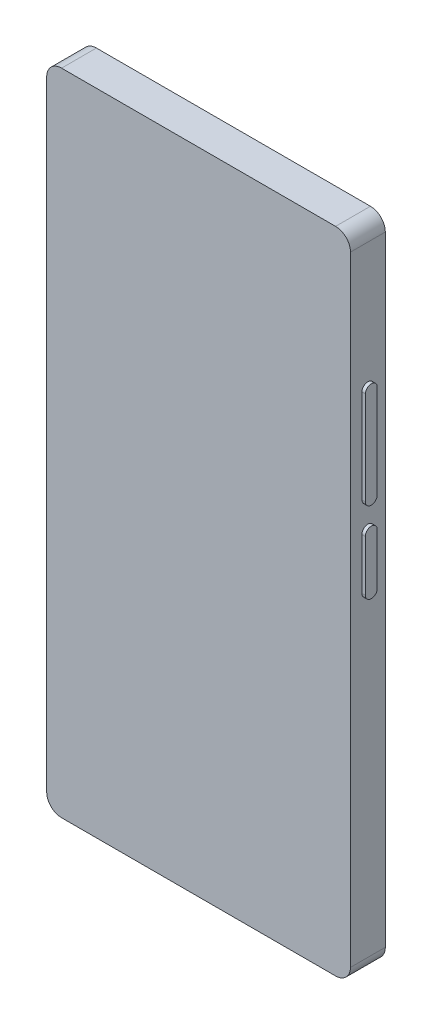
from build123d import *

# Parameters (mm, degrees)
SKETCH_1_W          = 71.5
SKETCH_1_H          = 152.8
EXTRUDE_1_DEPTH     = 8.2
FILLET_3_R          = 3.5
FILLET_4_R          = 3.5
FILLET_5_R          = 3.5
FILLET_6_R          = 3.5
EXTRUDE_3_DEPTH     = 0.8
EXTRUDE_4_DEPTH     = 0.8
SKETCH_5_W          = 42
SKETCH_5_H          = 42
EXTRUDE_5_DEPTH     = 1.5
FILLET_10_R         = 3.5
FILLET_11_R         = 3.5
FILLET_12_R         = 3.5
FILLET_13_R         = 3.5
CUT_EXTRUDE_1_DEPTH = 10
SKETCH_7_W          = 6
SKETCH_7_H          = 0.5
EXTRUDE_6_DEPTH     = 8
SKETCH_8_R          = 1.25
CUT_EXTRUDE_2_DEPTH = 10
CUT_EXTRUDE_3_DEPTH = 10
SKETCH_13_W         = 35
SKETCH_13_H         = 35
EXTRUDE_7_DEPTH     = 1.5
FILLET_14_R         = 3.5
CUT_EXTRUDE_4_DEPTH = 10


with BuildPart() as part:
    # 草图1 → 凸台-拉伸1 (new body)
    with BuildSketch(Plane.XY):
        Rectangle(SKETCH_1_W, SKETCH_1_H)
    extrude(amount=EXTRUDE_1_DEPTH)

    # 圆角3
    fillet_3_edges = [part.edges().sort_by_distance(p)[0] for p in [
        (-35.75, 76.4, 4.1),
    ]]
    fillet(fillet_3_edges, radius=FILLET_3_R)

    # 圆角4
    fillet_4_edges = [part.edges().sort_by_distance(p)[0] for p in [
        (35.75, 76.4, 4.1),
    ]]
    fillet(fillet_4_edges, radius=FILLET_4_R)

    # 圆角5
    fillet_5_edges = [part.edges().sort_by_distance(p)[0] for p in [
        (35.75, -76.4, 4.1),
    ]]
    fillet(fillet_5_edges, radius=FILLET_5_R)

    # 圆角6
    fillet_6_edges = [part.edges().sort_by_distance(p)[0] for p in [
        (-35.75, -76.4, 4.1),
    ]]
    fillet(fillet_6_edges, radius=FILLET_6_R)

    # 草图3 → 凸台-拉伸3 (add)
    with BuildSketch(Plane(origin=(35.75, 0, 0), x_dir=(0, 0, -1), z_dir=(1, 0, 0))):
        with BuildLine():
            Line((-5.499995889, 43.056517333), (-5.499995889, 21.056517333))
            ThreePointArc((-5.499995889, 21.056517333), (-4.142644, 19.672279908), (-2.703526658, 20.971302108))
            Line((-2.703526658, 20.971302108), (-2.703526658, 42.915947634))
            ThreePointArc((-2.703526658, 42.915947634), (-4.029693086, 44.419944517), (-5.499995889, 43.056517333))
        make_face()
    extrude(amount=EXTRUDE_3_DEPTH)

    # 草图4 → 凸台-拉伸4 (add)
    with BuildSketch(Plane(origin=(35.75, 0, 0), x_dir=(0, 0, -1), z_dir=(1, 0, 0))):
        with BuildLine():
            Line((-5.5, 14), (-5.5, 2))
            ThreePointArc((-5.5, 2), (-4.1, 0.6), (-2.7, 2))
            Line((-2.7, 2), (-2.7, 14))
            ThreePointArc((-2.7, 14), (-4.1, 15.4), (-5.5, 14))
        make_face()
    extrude(amount=EXTRUDE_4_DEPTH)

    # 草图5 → 凸台-拉伸5 (add)
    with BuildSketch(Plane(origin=(0, 0, 0), x_dir=(-1, 0, 0), z_dir=(0, 0, -1))):
        with Locations((-12, 52)):
            Rectangle(SKETCH_5_W, SKETCH_5_H)
    extrude(amount=EXTRUDE_5_DEPTH)

    # 圆角10
    fillet_10_edges = [part.edges().sort_by_distance(p)[0] for p in [
        (33, 73, -0.75),
    ]]
    fillet(fillet_10_edges, radius=FILLET_10_R)

    # 圆角11
    fillet_11_edges = [part.edges().sort_by_distance(p)[0] for p in [
        (-9, 73, -0.75),
    ]]
    fillet(fillet_11_edges, radius=FILLET_11_R)

    # 圆角12
    fillet_12_edges = [part.edges().sort_by_distance(p)[0] for p in [
        (33, 31, -0.75),
    ]]
    fillet(fillet_12_edges, radius=FILLET_12_R)

    # 圆角13
    fillet_13_edges = [part.edges().sort_by_distance(p)[0] for p in [
        (-9, 31, -0.75),
    ]]
    fillet(fillet_13_edges, radius=FILLET_13_R)

    # 草图6 → 切除-拉伸1 (cut)
    with BuildSketch(Plane(origin=(0, -76.4, 0), x_dir=(-1, 0, 0), z_dir=(0, -1, 0))):
        with BuildLine():
            Line((3, -6.35), (-3, -6.35))
            ThreePointArc((-3, -6.35), (-4.060660172, -5.910660172), (-4.5, -4.85))
            Line((-4.5, -4.85), (-4.5, -3.35))
            ThreePointArc((-4.5, -3.35), (-4.060660172, -2.289339828), (-3, -1.85))
            Line((-3, -1.85), (3, -1.85))
            ThreePointArc((3, -1.85), (4.060660172, -2.289339828), (4.5, -3.35))
            Line((4.5, -3.35), (4.5, -4.85))
            ThreePointArc((4.5, -4.85), (4.060660172, -5.910660172), (3, -6.35))
        make_face()
    extrude(amount=-CUT_EXTRUDE_1_DEPTH, mode=Mode.SUBTRACT)

    # 草图7 → 凸台-拉伸6 (add)
    with BuildSketch(Plane(origin=(0, -66.4, 0), x_dir=(-1, 0, 0), z_dir=(0, -1, 0))):
        with Locations((0, -4.1)):
            Rectangle(SKETCH_7_W, SKETCH_7_H)
    extrude(amount=EXTRUDE_6_DEPTH)

    # 草图8 → 切除-拉伸2 (cut)
    with BuildSketch(Plane(origin=(0, -76.4, 0), x_dir=(-1, 0, 0), z_dir=(0, -1, 0))):
        with Locations(Location((-9.942250917, -4.1, 0), (0, 0, 90))):
            Circle(SKETCH_8_R)
        with Locations(Location((-12.942250917, -4.1, 0), (0, 0, 90))):
            Circle(SKETCH_8_R)
        with Locations(Location((-15.942250917, -4.1, 0), (0, 0, 90))):
            Circle(SKETCH_8_R)
        with Locations(Location((-18.942250917, -4.1, 0), (0, 0, 90))):
            Circle(SKETCH_8_R)
        with Locations(Location((-21.942250917, -4.1, 0), (0, 0, 90))):
            Circle(SKETCH_8_R)
        with Locations(Location((-24.942250917, -4.1, 0), (0, 0, 90))):
            Circle(SKETCH_8_R)
        with Locations(Location((-27.942250917, -4.1, 0), (0, 0, 90))):
            Circle(SKETCH_8_R)
    extrude(amount=-CUT_EXTRUDE_2_DEPTH, mode=Mode.SUBTRACT)

    # 草图11 → 切除-拉伸3 (cut)
    with BuildSketch(Plane.XZ.offset(76.4)):
        with BuildLine():
            Line((-9.2, 5.1), (-8.8, 5.1))
            ThreePointArc((-8.8, 5.1), (-8.587867966, 5.012132034), (-8.5, 4.8))
            Line((-8.5, 4.8), (-8.5, 3.4))
            ThreePointArc((-8.5, 3.4), (-8.587867966, 3.187867966), (-8.8, 3.1))
            Line((-8.8, 3.1), (-9.2, 3.1))
            ThreePointArc((-9.2, 3.1), (-9.412132034, 3.187867966), (-9.5, 3.4))
            Line((-9.5, 3.4), (-9.5, 4.8))
            ThreePointArc((-9.5, 4.8), (-9.412132034, 5.012132034), (-9.2, 5.1))
        make_face()
    extrude(amount=-CUT_EXTRUDE_3_DEPTH, mode=Mode.SUBTRACT)

    # 草图13 → 凸台-拉伸7 (add)
    with BuildSketch(Plane(origin=(0, 0, -1.5), x_dir=(-1, 0, 0), z_dir=(0, 0, -1))):
        with Locations((-12, 52)):
            Rectangle(SKETCH_13_W, SKETCH_13_H)
    extrude(amount=EXTRUDE_7_DEPTH)

    # 圆角14
    fillet_14_edges = [part.edges().sort_by_distance(p)[0] for p in [
        (-5.5, 34.5, -2.25),
        (-5.5, 69.5, -2.25),
        (29.5, 69.5, -2.25),
        (29.5, 34.5, -2.25),
    ]]
    fillet(fillet_14_edges, radius=FILLET_14_R)

    # 草图14 → 切除-拉伸4 (cut)
    with BuildSketch(Plane(origin=(0, -76.4, 0), x_dir=(-1, 0, 0), z_dir=(0, -1, 0))):
        with BuildLine():
            Line((16.012447704, -2.550259118), (28.012447704, -2.64984418))
            ThreePointArc((28.012447704, -2.64984418), (29.499948351, -4.162240235), (27.987552296, -5.649740882))
            Line((27.987552296, -5.649740882), (15.987552296, -5.55015582))
            ThreePointArc((15.987552296, -5.55015582), (14.500051649, -4.037759765), (16.012447704, -2.550259118))
        make_face()
    extrude(amount=-CUT_EXTRUDE_4_DEPTH, mode=Mode.SUBTRACT)


solid = part.part
